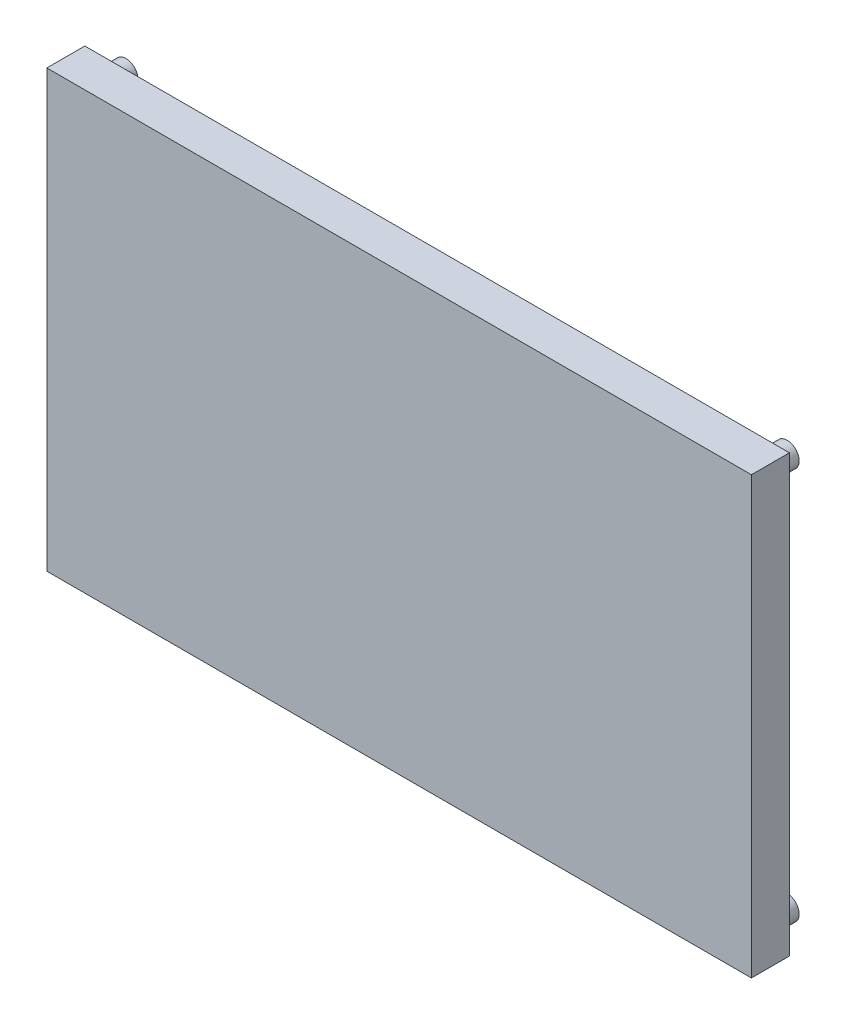
from build123d import *

# Parameters (mm, degrees)
SKETCH1_W           = 164.89
SKETCH1_H           = 102
BOSS_EXTRUDE1_DEPTH = 8.89
SKETCH2_R           = 2.794
BOSS_EXTRUDE2_DEPTH = 4.572
SKETCH3_R           = 2.794
BOSS_EXTRUDE3_DEPTH = 5.588


with BuildPart() as part:
    # Sketch1 → Boss-Extrude1 (new body)
    with BuildSketch(Plane.XY):
        Rectangle(SKETCH1_W, SKETCH1_H)
    extrude(amount=-BOSS_EXTRUDE1_DEPTH)

    # Sketch2 → Boss-Extrude2 (add)
    with BuildSketch(Plane(origin=(0, 0, -8.89), x_dir=(-1, 0, 0), z_dir=(0, 0, -1))):
        with Locations(Location((-77.365, 45.92, 0), (0, 0, 180))):
            Circle(SKETCH2_R)
        with Locations(Location((77.365, 45.92, 0), (0, 0, 180))):
            Circle(SKETCH2_R)
        with Locations(Location((-77.365, -45.92, 0), (0, 0, 180))):
            Circle(SKETCH2_R)
        with Locations(Location((77.365, -45.92, 0), (0, 0, 180))):
            Circle(SKETCH2_R)
    extrude(amount=BOSS_EXTRUDE2_DEPTH)

    # Sketch3 → Boss-Extrude3 (add)
    with BuildSketch(Plane(origin=(0, 0, -8.89), x_dir=(-1, 0, 0), z_dir=(0, 0, -1))):
        with Locations(Location((-21.739, 15.78, 0), (0, 0, 180))):
            Circle(SKETCH3_R)
        with Locations(Location((-21.739, -33.22, 0), (0, 0, 180))):
            Circle(SKETCH3_R)
        with Locations(Location((23.351, -33.22, 0), (0, 0, 180))):
            Circle(SKETCH3_R)
        with Locations(Location((23.351, 15.78, 0), (0, 0, 180))):
            Circle(SKETCH3_R)
    extrude(amount=BOSS_EXTRUDE3_DEPTH)


solid = part.part
